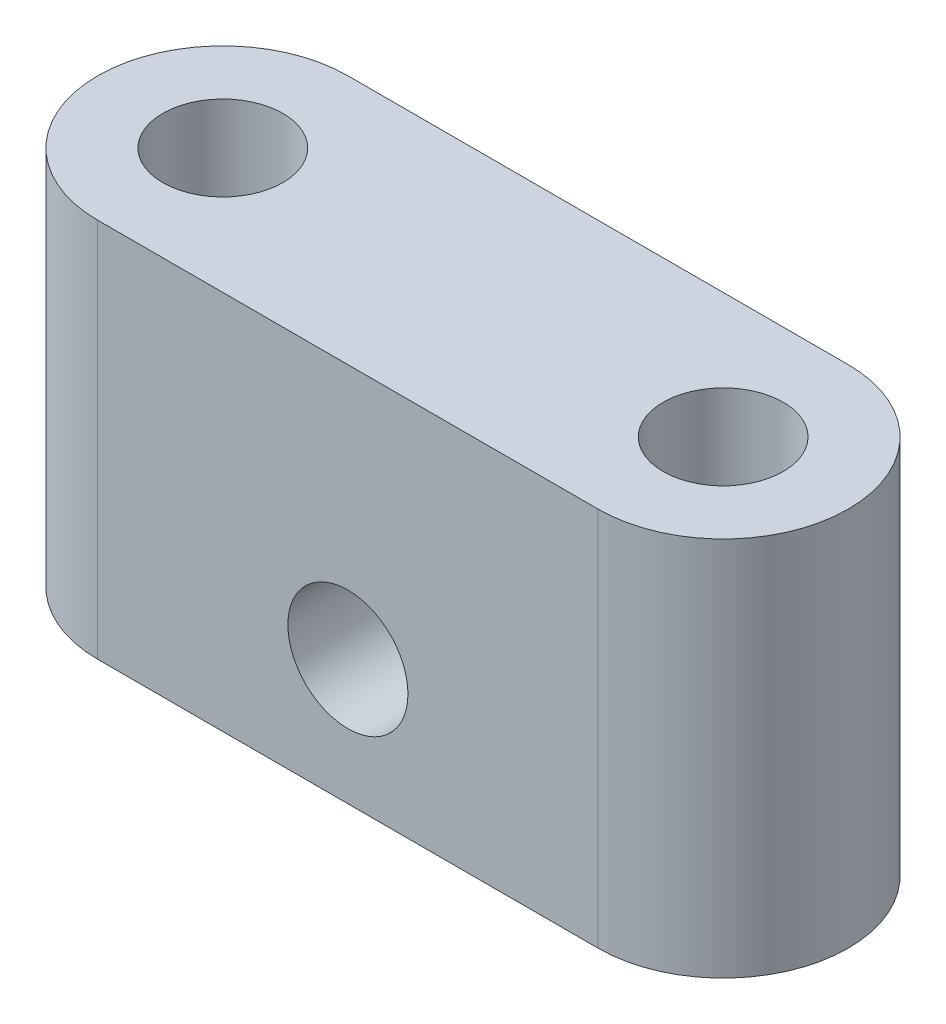
from build123d import *

# Parameters (mm, degrees)
SKETCH1_R           = 6
BOSS_EXTRUDE1_DEPTH = 19
HOLE1_D             = 12
HOLE1_DEPTH         = 12.5


with BuildPart() as part:
    # Sketch1 → Boss-Extrude1 (new, symmetric)
    with BuildSketch(Plane(origin=(0, 0, 0), x_dir=(1, 0, 0), z_dir=(0, 1, 0))):
        with BuildLine():
            Line((-25, 12.5), (25, 12.5))
            ThreePointArc((25, 12.5), (37.5, 0), (25, -12.5))
            Line((25, -12.5), (-25, -12.5))
            ThreePointArc((-25, -12.5), (-37.5, 0), (-25, 12.5))
        make_face()
        with Locations(Location((-25, 0, 0), (0, 0, 270))):
            Circle(SKETCH1_R, mode=Mode.SUBTRACT)
        with Locations(Location((25, 0, 0), (0, 0, 270))):
            Circle(SKETCH1_R, mode=Mode.SUBTRACT)
    extrude(amount=BOSS_EXTRUDE1_DEPTH, both=True)

    # Hole1
    with Locations(Plane.XY.offset(12.5)):
        with Locations((0, -6.5)):
            Hole(HOLE1_D / 2, depth=HOLE1_DEPTH)


solid = part.part
